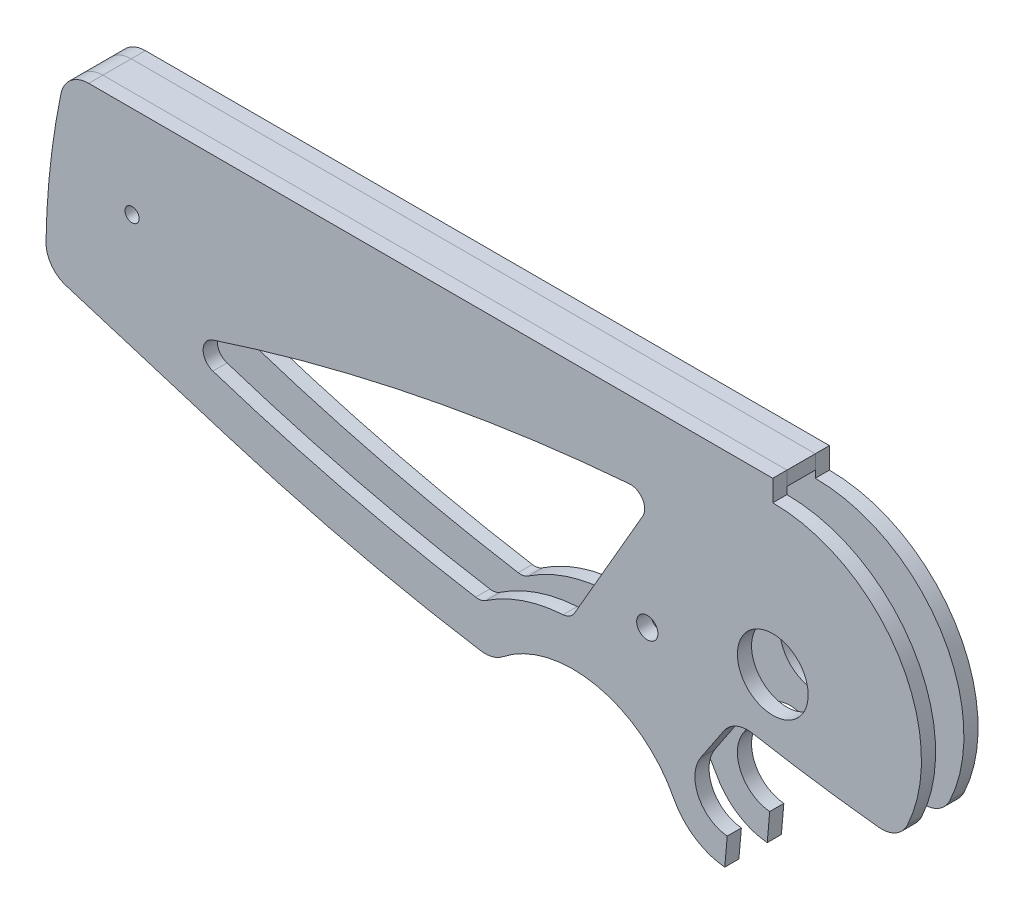
from build123d import *

# Parameters (mm, degrees)
SKICA1_R                 = 2.5
P_IDAT_VYSUNUT_M1_DEPTH  = 1
ODEBRAT_VYSUNUT_M3_DEPTH = 54.105492035
SKICA2_R                 = 0.75
SKICA2_R_2               = 0.5
ODEBRAT_VYSUNUT_M2_DEPTH = 54.105492035
P_IDAT_VYSUNUT_M2_DEPTH  = 1


with BuildPart() as part:
    # Skica1 → Přidat vysunutím1 (new body)
    with BuildSketch(Plane.XY.offset(1)):
        with BuildLine():
            Line((-3.451850397, -5.17306034), (-5.079542319, -7.612374783))
            ThreePointArc((-5.079542319, -7.612374783), (-5.253771545, -10.081902872), (-3.217889357, -11.490486745))
            Line((-3.217889357, -11.490486745), (-3.392200842, -13.482876141))
            ThreePointArc((-3.392200842, -13.482876141), (-5.507699887, -12.736501208), (-7, -11.061552813))
            ThreePointArc((-7, -11.061552813), (-12.421451418, -6.907005546), (-19.074569669, -8.452455647))
            ThreePointArc((-19.074569669, -8.452455647), (-19.810429728, -8.819128255), (-20.631627839, -8.858782909))
            ThreePointArc((-20.631627839, -8.858782909), (-29.612816832, -7.095755552), (-38.448343472, -4.707557447))
            Line((-38.448343472, -4.707557447), (-49.915705076, -1.172077587))
            ThreePointArc((-49.915705076, -1.172077587), (-50.944425281, -0.436513563), (-51.326233925, 0.769115673))
            ThreePointArc((-51.326233925, 0.769115673), (-51.024263074, 5.612344033), (-50.266302206, 10.405416394))
            ThreePointArc((-50.266302206, 10.405416394), (-49.570592062, 11.550940487), (-48.307823831, 12))
            Line((-48.307823831, 12), (0, 12))
            Line((0, 12), (0, 10.5))
            ThreePointArc((0, 10.5), (8.864205709, 5.628130874), (9.502649492, -4.466503402))
            ThreePointArc((9.502649492, -4.466503402), (8.672376262, -5.35932327), (7.478006155, -5.604192624))
            ThreePointArc((7.478006155, -5.604192624), (3.01210543, -5.04033823), (-1.430493256, -4.315412042))
            ThreePointArc((-1.430493256, -4.315412042), (-2.569395622, -4.442030631), (-3.451850397, -5.17306034))
        make_face()
        Circle(SKICA1_R, mode=Mode.SUBTRACT)
    extrude(amount=P_IDAT_VYSUNUT_M1_DEPTH)

    # Skica14 → Odebrat vysunutím3 (cut, through all)
    with BuildSketch(Plane.XY):
        with BuildLine():
            Line((-14.000954762, -3.250365002), (-9.180543984, 5.098831378))
            ThreePointArc((-9.180543984, 5.098831378), (-9.201183144, 6.132986878), (-10.126304066, 6.5956475))
            ThreePointArc((-10.126304066, 6.5956475), (-25.0093231, 4.513187085), (-39.5421575, 0.687272652))
            ThreePointArc((-39.5421575, 0.687272652), (-40.23080172, -0.263668209), (-39.540926846, -1.21371665))
            ThreePointArc((-39.540926846, -1.21371665), (-30.346748023, -3.835878825), (-20.981929874, -5.761713644))
            ThreePointArc((-20.981929874, -5.761713644), (-20.60514794, -5.752569661), (-20.258511168, -5.604612957))
            ThreePointArc((-20.258511168, -5.604612957), (-17.654944999, -4.313023149), (-14.803991078, -3.748379218))
            ThreePointArc((-14.803991078, -3.748379218), (-14.339939825, -3.600205269), (-14.000954762, -3.250365002))
        make_face()
    extrude(amount=ODEBRAT_VYSUNUT_M3_DEPTH, mode=Mode.SUBTRACT)

    # Skica2 → Odebrat vysunutím2 (cut, through all)
    with BuildSketch(Plane.XY):
        with Locations((-8.863269777, -1.562833599)):
            Circle(SKICA2_R)
        with Locations((-45.246630015, 5.5)):
            Circle(SKICA2_R_2)
    extrude(amount=ODEBRAT_VYSUNUT_M2_DEPTH, mode=Mode.SUBTRACT)


with BuildPart() as body_2:
    # Skica16 → Přidat vysunutím2 (new, symmetric)
    with BuildSketch(Plane(origin=(0, 0, 0), x_dir=(-1, 0, 0), z_dir=(0, 0, -1))):
        with BuildLine():
            Line((0, 12), (48.307823831, 12))
            ThreePointArc((48.307823831, 12), (49.570592062, 11.550940487), (50.266302206, 10.405416394))
            ThreePointArc((50.266302206, 10.405416394), (51.024263074, 5.612344033), (51.326233925, 0.769115673))
            ThreePointArc((51.326233925, 0.769115673), (51.324464931, 0.649874315), (51.31559221, 0.530950366))
            ThreePointArc((51.31559221, 0.530950366), (26.186308465, 8.356056534), (0, 11))
            Line((0, 11), (0, 12))
        make_face()
    extrude(amount=P_IDAT_VYSUNUT_M2_DEPTH, both=True)


with BuildPart() as body_3:
    # Zrcadlit1: mirrored copy
    add(part.part.mirror(Plane.XY))


solid = Compound([part.part, body_2.part, body_3.part])
